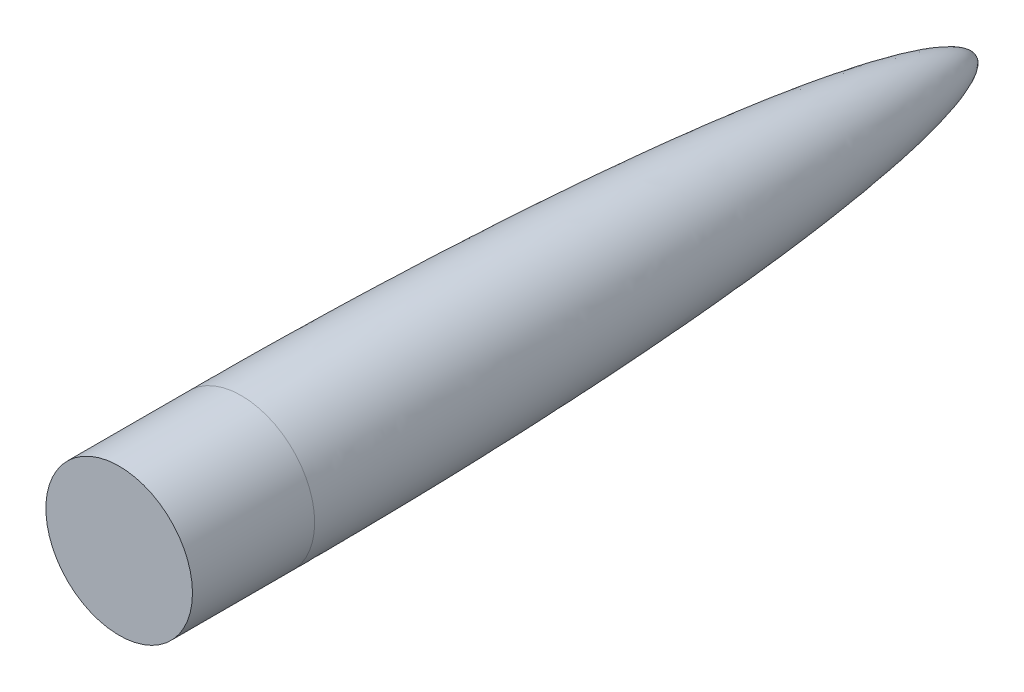
from build123d import *

# Parameters (mm, degrees)
SKETCH2_R           = 76.2
BOSS_EXTRUDE1_DEPTH = 127


with BuildPart() as part:
    # Sketch1 → Revolve1 (revolve)
    with BuildSketch(Plane(origin=(0, 0, 0), x_dir=(0, 0, -1), z_dir=(1, 0, 0))):
        with BuildLine():
            Line((0, 76.2), (0, 0))
            Line((0, 0), (762, 0))
            add(Edge.make_bspline(
                [(0, 76.2), (3.444818104, 76.2), (7.707644969, 76.19686838), (14.892365203, 76.188413012), (21.478756426, 76.169617779), (29.522537352, 76.145806533), (39.598292117, 76.10098801), (53.052649609, 76.021948219), (68.065099576, 75.901341261), (83.269759086, 75.750316983), (98.362667519, 75.568694102), (113.521785183, 75.356256889), (128.640171029, 75.112743812), (143.782440946, 74.837862162), (158.909284972, 74.531259641), (174.044415613, 74.192565633), (189.173388186, 73.821317355), (204.304699793, 73.417073214), (219.433291243, 72.979222414), (238.343835211, 72.389279468), (261.033679037, 71.611583805), (295.064010425, 70.310564845), (340.425271329, 68.274091046), (393.324055346, 65.421933445), (453.734719278, 61.408154248), (514.079621007, 56.489392811), (566.790800709, 51.175633377), (611.862125806, 45.627893186), (647.387926465, 40.333421248), (670.645230155, 36.299110575), (689.135822315, 32.594813789), (703.156611323, 29.422453941), (714.615330258, 26.536981051), (726.400675577, 23.156494002), (737.112527419, 19.495024056), (745.772601329, 15.839419247), (752.002079813, 12.434272758), (755.60935351, 9.940121258), (757.830468181, 8.032232587), (759.271379797, 6.50167925), (760.260109141, 5.203286944), (760.927979402, 4.095942308), (761.371516483, 3.146692178), (761.767441532, 2.014774351), (761.943391779, 1.148460367), (761.99941294, 0.486576307), (762, 0)],
                knots=[0.089607623, 0.089607623, 0.089607623, 0.089607623, 0.089607623, 0.107405999, 0.111855593, 0.116305187, 0.125204375, 0.143002751, 0.160801127, 0.178599503, 0.196397879, 0.214196255, 0.231994631, 0.249793007, 0.267591383, 0.285389759, 0.303188135, 0.320986511, 0.338784887, 0.356583263, 0.374381639, 0.409978391, 0.445575143, 0.516768647, 0.58796215, 0.659155654, 0.730349157, 0.801542658, 0.837139406, 0.872736154, 0.89928468, 0.912558943, 0.925833205, 0.940347229, 0.954861253, 0.970211187, 0.979054618, 0.984497876, 0.988198736, 0.990803837, 0.992802826, 0.994367796, 0.995861628, 0.99687456, 0.997721982, 1, 1, 1, 1, 1], degree=4))
        make_face()
    revolve(axis=Axis((0, 0, -480.06), (0, 0, 1)))

    # Sketch2 → Boss-Extrude1 (add)
    with BuildSketch(Plane.XY):
        Circle(SKETCH2_R)
    extrude(amount=BOSS_EXTRUDE1_DEPTH)


solid = part.part
